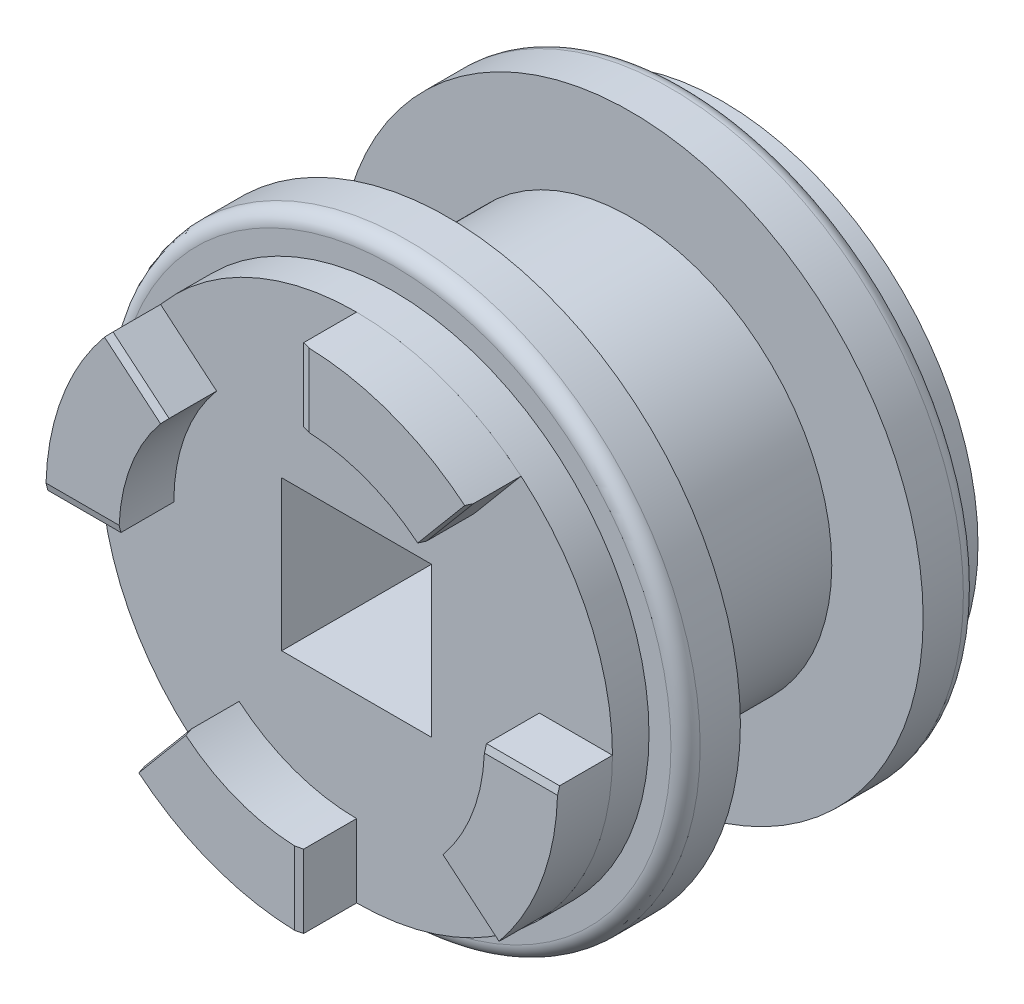
from build123d import *
from OCP.BRepFilletAPI import BRepFilletAPI_MakeChamfer

# Parameters (mm, degrees)
SKETCH1_R               = 7
BOSS_EXTRUDE1_DEPTH     = 10
BOSS_EXTRUDE2_DEPTH     = 1.5
CHAMFER2_SIZE           = 0.2
CHAMFER2_SIZE2          = 0.053589838
CIRPATTERN1_COUNT       = 4
SKETCH11_W              = 4.1
SKETCH11_H              = 4.1
CUT_EXTRUDE1_DEPTH      = 10
SKETCH12_R              = 8
SKETCH12_R_2            = 7
BOSS_EXTRUDE3_DEPTH     = 4
SKETCH12_2_R            = 8
SKETCH12_2_R_2          = 5.5
CUT_EXTRUDE_THIN1_DEPTH = 2.5
FILLET3_R               = 0.4
SKETCH11_3_R            = 3.7
SKETCH11_3_W            = 4.1
SKETCH11_3_H            = 4.1
CUT_EXTRUDE2_DEPTH      = 2


with BuildPart() as part:
    # Sketch1 → Boss-Extrude1 (new body)
    with BuildSketch(Plane.XY):
        Circle(SKETCH1_R)
    extrude(amount=BOSS_EXTRUDE1_DEPTH)

    # Sketch11 → Cut-Extrude1 (cut)
    with BuildSketch(Plane(origin=(0, 0, 0), x_dir=(-1, 0, 0), z_dir=(0, 0, -1))):
        Rectangle(SKETCH11_W, SKETCH11_H)
    extrude(amount=-CUT_EXTRUDE1_DEPTH, mode=Mode.SUBTRACT)

    # Sketch12 → Boss-Extrude3 (add, symmetric)
    with BuildSketch(Plane.XY.offset(5)):
        Circle(SKETCH12_R)
        Circle(SKETCH12_R_2, mode=Mode.SUBTRACT)
    extrude(amount=BOSS_EXTRUDE3_DEPTH, both=True)

    # Sketch12<2> → Cut-Extrude-Thin1 (cut, symmetric)
    with BuildSketch(Plane.XY.offset(5)):
        Circle(SKETCH12_2_R)
        Circle(SKETCH12_2_R_2, mode=Mode.SUBTRACT)
    extrude(amount=CUT_EXTRUDE_THIN1_DEPTH, both=True, mode=Mode.SUBTRACT)

    # Fillet3
    fillet3_edges = [part.edges().sort_by_distance(p)[0] for p in [
        (-8, 0, 9),
        (-8, 0, 1),
    ]]
    fillet(fillet3_edges, radius=FILLET3_R)

    # Sketch11<3> → Cut-Extrude2 (cut)
    with BuildSketch(Plane(origin=(0, 0, 0), x_dir=(-1, 0, 0), z_dir=(0, 0, -1))):
        Circle(SKETCH11_3_R)
        Rectangle(SKETCH11_3_W, SKETCH11_3_H, mode=Mode.SUBTRACT)
    extrude(amount=-CUT_EXTRUDE2_DEPTH, mode=Mode.SUBTRACT)


with BuildPart() as body_2:
    # Sketch2 → Boss-Extrude2 (new body)
    with BuildSketch(Plane.XY.offset(10)):
        with BuildLine():
            Line((0, 7), (0, 5))
            ThreePointArc((0, 5), (0.348782369, 4.987820251), (0.695865505, 4.951340344))
            Line((0.695865505, 4.951340344), (0.974211707, 6.931876481))
            ThreePointArc((0.974211707, 6.931876481), (0.488295316, 6.982948352), (0, 7))
        make_face()
        with BuildLine():
            Line((0.974211707, 6.931876481), (0.695865505, 4.951340344))
            ThreePointArc((0.695865505, 4.951340344), (2.033683215, 4.567727288), (3.213938048, 3.830222216))
            Line((3.213938048, 3.830222216), (4.499513268, 5.362311102))
            ThreePointArc((4.499513268, 5.362311102), (2.847156502, 6.394818203), (0.974211707, 6.931876481))
        make_face()
    extrude(amount=BOSS_EXTRUDE2_DEPTH)

    # Chamfer2: one chamfer whose edges measure the first distance from different faces: ONE call of the kernel's chamfer builder (chamfer() names one face for all edges)
    chamfer2_edges_1 = [body_2.edges().sort_by_distance(p)[0] for p in [
        (3.856725658, 4.596266659, 11.5),
    ]]
    chamfer2_side_1 = [body_2.faces().sort_by_distance(p)[0] for p in [
        (3.856725658, 4.596266659, 10.75),
    ]]
    chamfer2_edges_2 = [body_2.edges().sort_by_distance(p)[0] for p in [
        (0, 6, 11.5),
    ]]
    chamfer2_side_2 = [body_2.faces().sort_by_distance(p)[0] for p in [
        (2.029317492, 5.575503986, 11.5),
    ]]
    chamfer2 = BRepFilletAPI_MakeChamfer(body_2.part.solid().wrapped)
    for e in chamfer2_edges_1:
        chamfer2.Add(CHAMFER2_SIZE, CHAMFER2_SIZE2, e.wrapped, chamfer2_side_1[0].wrapped)  # the first distance lies on this face
    for e in chamfer2_edges_2:
        chamfer2.Add(CHAMFER2_SIZE, CHAMFER2_SIZE2, e.wrapped, chamfer2_side_2[0].wrapped)  # the first distance lies on this face
    add(Compound.cast(chamfer2.Shape()), mode=Mode.REPLACE)


with BuildPart() as cirpattern1_1:
    # CirPattern1: pattern copy
    add(body_2.part.rotate(Axis((0, 0, 0), (0, 0, 1)), 1 * 360 / CIRPATTERN1_COUNT))


with BuildPart() as cirpattern1_2:
    # CirPattern1: pattern copy
    add(body_2.part.rotate(Axis((0, 0, 0), (0, 0, 1)), 2 * 360 / CIRPATTERN1_COUNT))


with BuildPart() as cirpattern1_3:
    # CirPattern1: pattern copy
    add(body_2.part.rotate(Axis((0, 0, 0), (0, 0, 1)), 3 * 360 / CIRPATTERN1_COUNT))


solid = Compound([part.part, body_2.part, cirpattern1_1.part, cirpattern1_2.part, cirpattern1_3.part])
